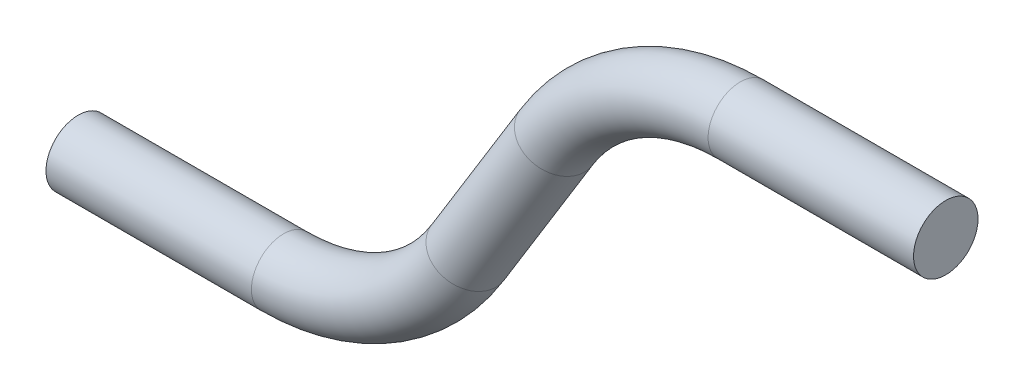
from build123d import *

# Parameters (mm, degrees)
SKETCH_3_R = 2.15


with BuildPart() as part:
    # ｽｲｰﾌﾟ1: sweep along a path in ｽｹｯﾁ2
    with BuildLine(Plane(origin=(0, -4.424778761, -66.371681416), x_dir=(-1, 0, 0), z_dir=(0, -0.06651901052377338, -0.997785157856609))) as sweep_1_path:
        Line((123.043127582, 39.512292251), (136.743127582, 39.512292251))
        ThreePointArc((136.743127582, 39.512292251), (143.556877087, 37.70090142), (148.571584156, 32.744992617))
        Line((148.571584156, 32.744992617), (153.871543426, 23.729647318))
        ThreePointArc((153.871543426, 23.729647318), (158.886250495, 18.773738514), (165.7, 16.962347684))
        Line((165.7, 16.962347684), (179.4, 16.962347684))
    # ｽｹｯﾁ3 → ｽｲｰﾌﾟ1 (sweep)
    with BuildSketch(Plane(origin=(-179.4, 0, 0), x_dir=(0, 0, -1), z_dir=(1, 0, 0))):
        with Locations((67.5, 12.5)):
            Circle(SKETCH_3_R)
    sweep(path=sweep_1_path.line)


solid = part.part
